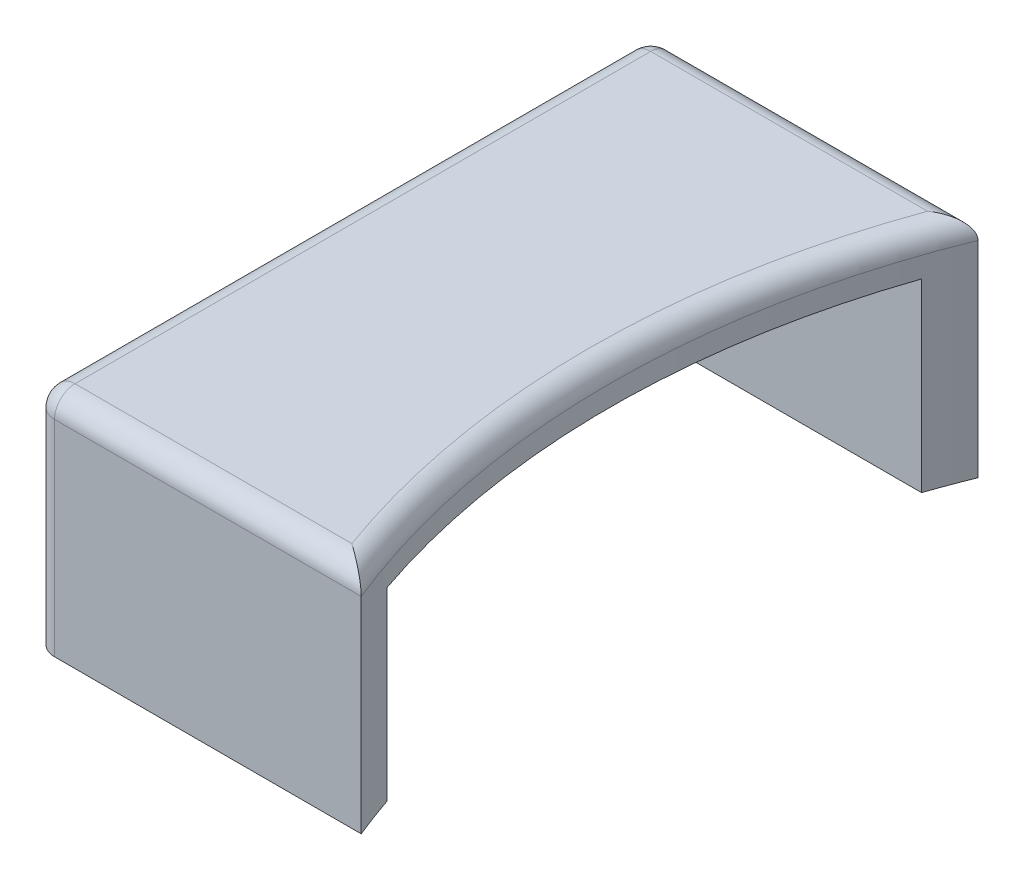
from build123d import *

# Parameters (mm, degrees)
BOSS_EXTRUDE1_DEPTH = 11
SHELL1_T            = -2
FILLET1_R           = 1


with BuildPart() as part:
    # Sketch1 → Boss-Extrude1 (new body)
    with BuildSketch(Plane(origin=(0, 0, 0), x_dir=(1, 0, 0), z_dir=(0, 1, 0))):
        with BuildLine():
            Line((0, 0), (0, 30))
            Line((0, 30), (15.92, 30))
            ThreePointArc((15.92, 30), (13.000920011, 15), (15.92, 0))
            Line((15.92, 0), (0, 0))
        make_face()
    extrude(amount=BOSS_EXTRUDE1_DEPTH)

    # Shell1
    shell1_openings = [part.faces().sort_by_distance(p)[0] for p in [
        (7.00647131, 0, -15),
        (13.000920011, 5.5, -15),
    ]]
    offset(amount=SHELL1_T, openings=shell1_openings, kind=Kind.INTERSECTION)

    # Fillet1
    fillet1_edges = [part.edges().sort_by_distance(p)[0] for p in [
        (7.96, 11, -30),
        (0, 11, -15),
        (7.96, 11, 0),
        (0, 5.5, 0),
        (0, 5.5, -30),
        (13.000920011, 11, -15),
    ]]
    fillet(fillet1_edges, radius=FILLET1_R)


solid = part.part
